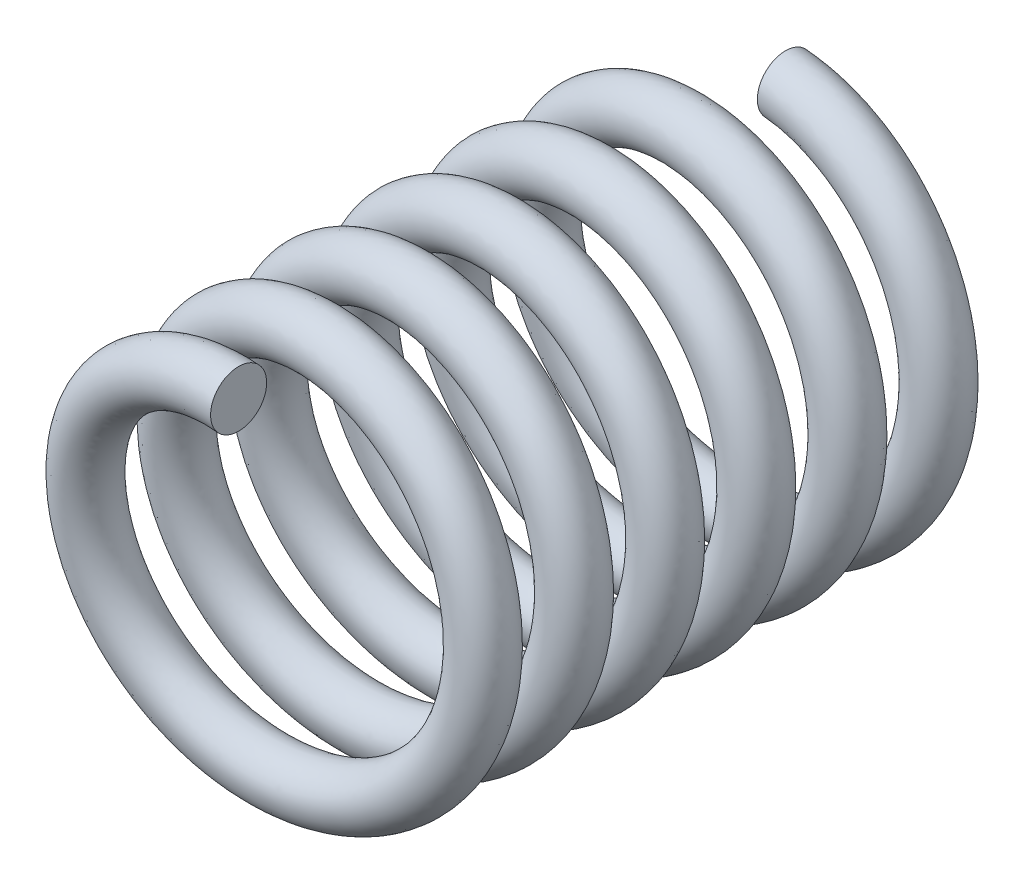
from build123d import *

# Parameters (mm, degrees)
COIL_SWEEP_PITCH       = 8.255
COIL_SWEEP_HEIGHT      = 49.53
COIL_SWEEP_RADIUS      = 15.875
COIL_SWEEP_START_ANGLE = 90
COIL_SKETCH_R          = 2.54


with BuildPart() as part:
    # Coil Sweep: sweep along a helix
    with BuildLine() as coil_sweep_path:
        add(Helix(COIL_SWEEP_PITCH, COIL_SWEEP_HEIGHT, COIL_SWEEP_RADIUS, center=(0, 0, 0), direction=(0, 0, 1), lefthand=True, mode=Mode.PRIVATE).rotate(Axis((0, 0, 0), (0, 0, 1)), COIL_SWEEP_START_ANGLE))
    # Coil Sketch → Coil Sweep (sweep)
    with BuildSketch(Plane(origin=(0, 0, 0), x_dir=(0, 0, -1), z_dir=(1, 0, 0))):
        with Locations((0, 15.875)):
            Circle(COIL_SKETCH_R)
    sweep(path=coil_sweep_path.line, is_frenet=True)


solid = part.part
